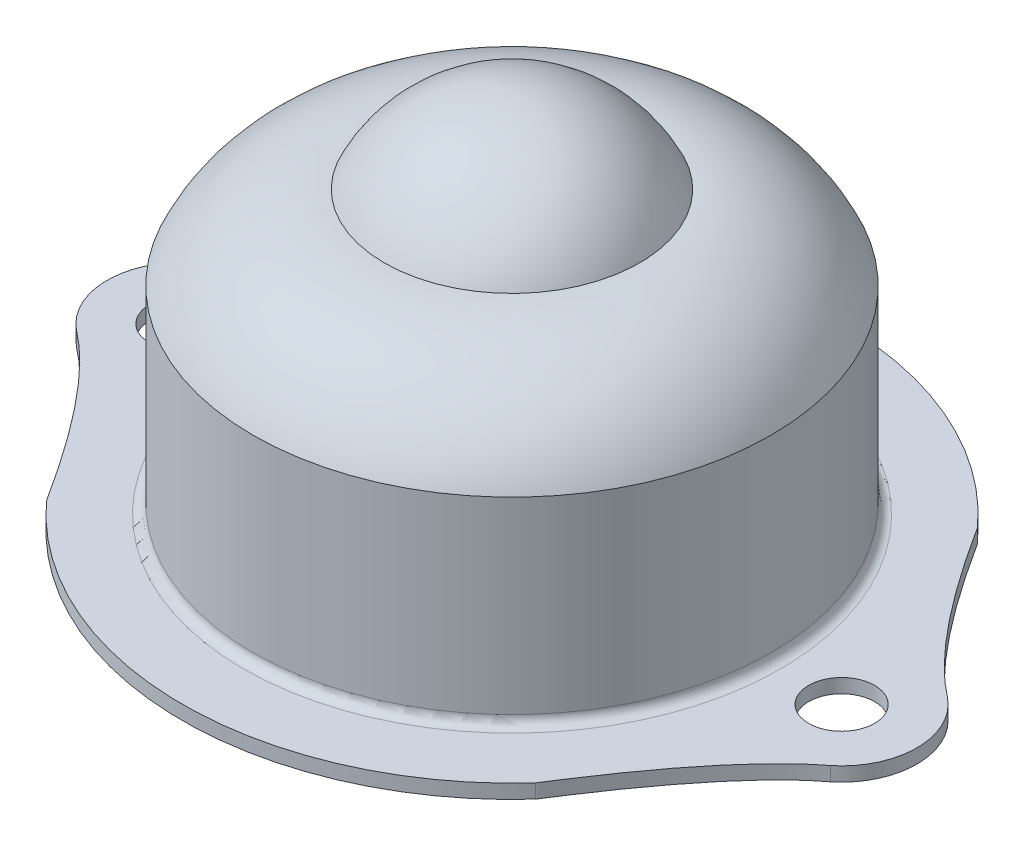
from build123d import *

# Parameters (mm, degrees)
SKETCH1_R           = 26
SKETCH1_R_2         = 3.5
BOSS_EXTRUDE1_DEPTH = 1.5
FILLET1_R           = 1


with BuildPart() as part:
    # Sketch1 → Boss-Extrude1 (new body)
    with BuildSketch(Plane(origin=(0, 0, 0), x_dir=(1, 0, 0), z_dir=(0, 1, 0))):
        with BuildLine():
            ThreePointArc((25.966330681, 23.468056395), (0, 35), (-25.966330681, 23.468056395))
            add(Edge.make_bspline(
                [(-40.028254969, 6.222270644), (-33.309609864, 11.270283014), (-26.179065421, 23.243656803), (-25.966330681, 23.468056395)],
                knots=[0, 0, 0, 0, 1, 1, 1, 1], degree=3))
            ThreePointArc((-40.028254969, 6.222270644), (-43, 0), (-40.028254969, -6.222270644))
            add(Edge.make_bspline(
                [(-40.028254969, -6.222270644), (-33.309609864, -11.270283014), (-26.179065421, -23.243656803), (-25.966330681, -23.468056395)],
                knots=[0, 0, 0, 0, 1, 1, 1, 1], degree=3))
            ThreePointArc((-25.966330681, -23.468056395), (0, -35), (25.966330681, -23.468056395))
            add(Edge.make_bspline(
                [(40.028254969, -6.222270644), (33.309609864, -11.270283014), (26.179065421, -23.243656803), (25.966330681, -23.468056395)],
                knots=[0, 0, 0, 0, 1, 1, 1, 1], degree=3))
            ThreePointArc((40.028254969, -6.222270644), (43, 0), (40.028254969, 6.222270644))
            add(Edge.make_bspline(
                [(40.028254969, 6.222270644), (33.309609864, 11.270283014), (26.179065421, 23.243656803), (25.966330681, 23.468056395)],
                knots=[0, 0, 0, 0, 1, 1, 1, 1], degree=3))
        make_face()
        with Locations(Location((0, 0, 0), (0, 0, 270))):
            Circle(SKETCH1_R, mode=Mode.SUBTRACT)
        with Locations(Location((-35, 0, 0), (0, 0, 270))):
            Circle(SKETCH1_R_2, mode=Mode.SUBTRACT)
        with Locations(Location((35, 0, 0), (0, 0, 90))):
            Circle(SKETCH1_R_2, mode=Mode.SUBTRACT)
    extrude(amount=BOSS_EXTRUDE1_DEPTH)

    # Sketch2 → Revolve1 (revolve)
    with BuildSketch(Plane(origin=(0, 0, 0), x_dir=(0, 0, -1), z_dir=(1, 0, 0))):
        with BuildLine():
            Line((0, 40), (0, 10))
            ThreePointArc((0, 10), (-15, 25), (0, 40))
        make_face()
        with BuildLine():
            Line((-27.5, 1.5), (-26, 1.5))
            Line((-26, 1.5), (-26, 22.5))
            ThreePointArc((-26, 22.5), (-21.002028258, 27.721893695), (-14.142135624, 30))
            ThreePointArc((-14.142135624, 30), (-13.874446892, 30.70085287), (-13.572050337, 31.387444689))
            ThreePointArc((-13.572050337, 31.387444689), (-21.863437849, 29.023975741), (-27.5, 22.5))
            Line((-27.5, 22.5), (-27.5, 1.5))
        make_face()
    revolve(axis=Axis((0, 42, 0), (0, -1, 0)))

    # Fillet1
    fillet1_edges = [part.edges().sort_by_distance(p)[0] for p in [
        (0, 1.5, -27.5),
    ]]
    fillet(fillet1_edges, radius=FILLET1_R)


with BuildPart() as body_2:
    # Sketch3 → Revolve2 (revolve)
    with BuildSketch(Plane.XY, mode=Mode.PRIVATE) as revolve2_sk:
        with BuildLine():
            Line((0, 1.5), (0, 0))
            ThreePointArc((0, 0), (-16.129522843, 5.963594864), (-24.5, 20.985614801))
            Line((-24.5, 20.985614801), (-24.466330681, 0))
            Line((-24.466330681, 0), (-25.966330681, 0))
            Line((-25.966330681, 0), (-25.966330681, 22.5))
            Line((-25.966330681, 22.5), (-23.181013127, 22.5))
            ThreePointArc((-23.181013127, 22.5), (-15.63936835, 7.530632465), (0, 1.5))
        make_face()
    revolve(revolve2_sk.sketch.rotate(Axis((0, 42, 0), (0, -1, 0)), 270), axis=Axis((0, 42, 0), (0, -1, 0)))


solid = Compound([part.part, body_2.part])
